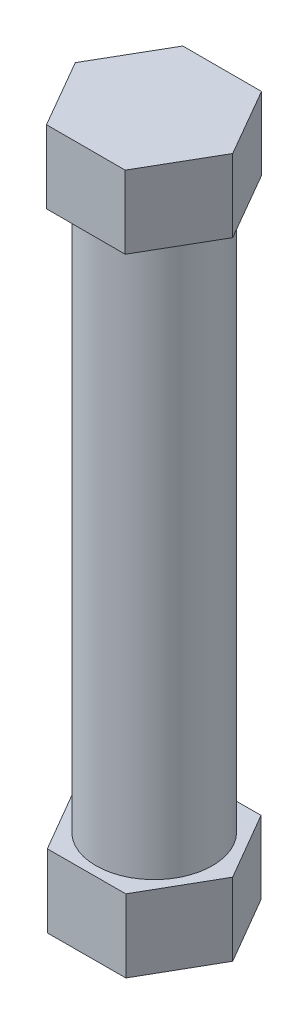
from build123d import *

# Parameters (mm, degrees)
SKETCH1_R           = 4
BOSS_EXTRUDE1_DEPTH = 38
BOSS_EXTRUDE2_DEPTH = 5
BOSS_EXTRUDE3_DEPTH = 5


with BuildPart() as part:
    # Sketch1 → Boss-Extrude1 (new body)
    with BuildSketch(Plane(origin=(0, 0, 0), x_dir=(1, 0, 0), z_dir=(0, 1, 0))):
        with Locations(Location((0, 0, 0), (0, 0, 270))):
            Circle(SKETCH1_R)
    extrude(amount=BOSS_EXTRUDE1_DEPTH)

    # Sketch2 → Boss-Extrude2 (add)
    with BuildSketch(Plane(origin=(0, 38, 0), x_dir=(1, 0, 0), z_dir=(0, 1, 0))):
        Polygon((5.37187828, 0.016236083), (2.67187828, 4.692773263), (-2.72812172, 4.692773263), (-5.42812172, 0.016236083), (-2.72812172, -4.660301098), (2.67187828, -4.660301098), align=None)
    extrude(amount=BOSS_EXTRUDE2_DEPTH)

    # Sketch3 → Boss-Extrude3 (add)
    with BuildSketch(Plane.XZ):
        Polygon((5.37187828, -0.016236083), (2.7, 4.644065015), (-2.67187828, 4.660301098), (-5.37187828, 0.016236083), (-2.7, -4.644065015), (2.67187828, -4.660301098), align=None)
    extrude(amount=BOSS_EXTRUDE3_DEPTH)


solid = part.part
